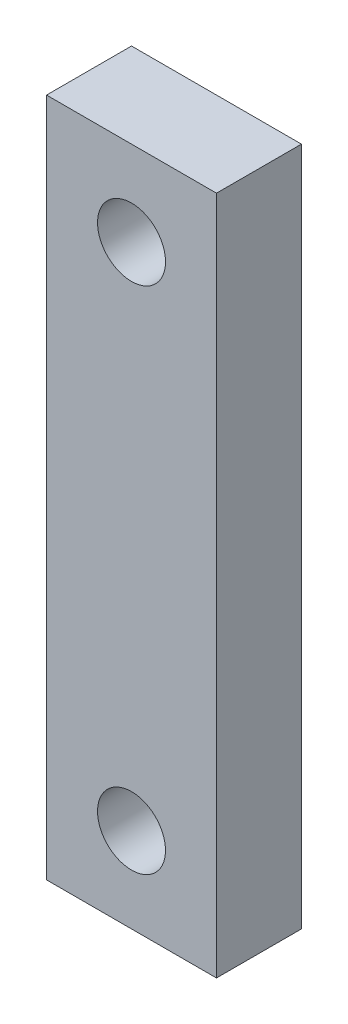
from build123d import *

# Parameters (mm, degrees)
ESQUISSE1_W             = 20
ESQUISSE1_H             = 80
BOSS_EXTRU_1_DEPTH      = 10
ESQUISSE2_R             = 4
ENL_V_MAT_EXTRU_1_DEPTH = 84.066238629


with BuildPart() as part:
    # Esquisse1 → Boss.-Extru.1 (new body)
    with BuildSketch(Plane.XY):
        with Locations((10, 40)):
            Rectangle(ESQUISSE1_W, ESQUISSE1_H)
    extrude(amount=BOSS_EXTRU_1_DEPTH)

    # Esquisse2 → Enlèv. mat.-Extru.1 (cut, through all)
    with BuildSketch(Plane.XY.offset(10)):
        with Locations((10, 70)):
            Circle(ESQUISSE2_R)
        with Locations(Location((10, 10, 0), (0, 0, 180))):
            Circle(ESQUISSE2_R)
    extrude(amount=-ENL_V_MAT_EXTRU_1_DEPTH, mode=Mode.SUBTRACT)


solid = part.part
